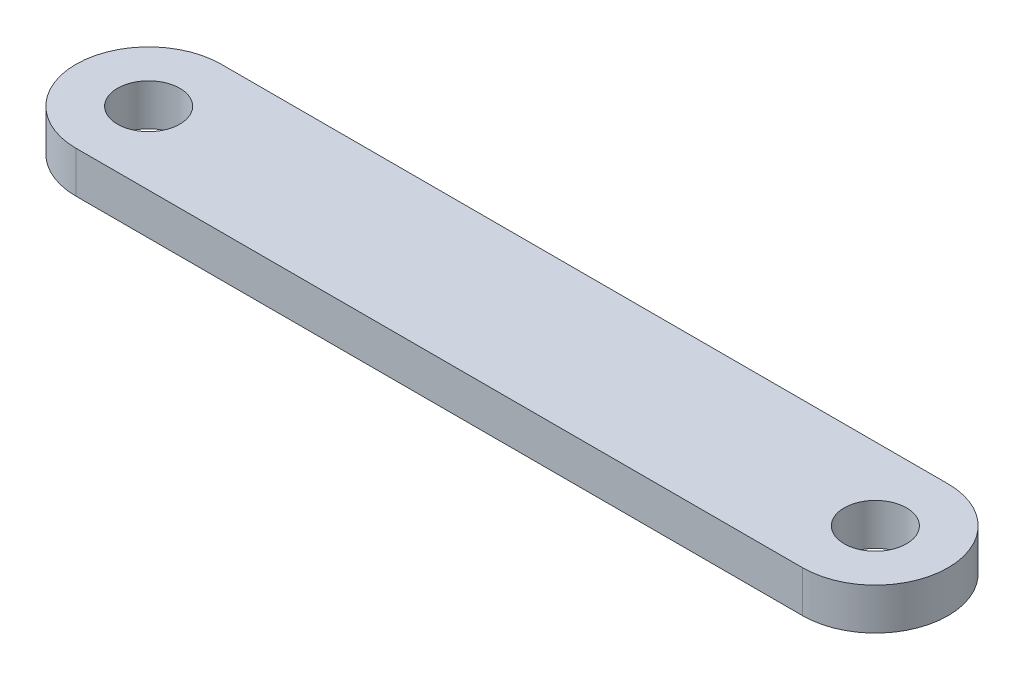
from build123d import *

# Parameters (mm, degrees)
SKETCH1_R           = 1.5
BOSS_EXTRUDE1_DEPTH = 2


with BuildPart() as part:
    # Sketch1 → Boss-Extrude1 (new body)
    with BuildSketch(Plane(origin=(0, 0, 0), x_dir=(1, 0, 0), z_dir=(0, 1, 0))):
        with BuildLine():
            Line((17.495, -3.5), (-17.495, -3.5))
            ThreePointArc((-17.495, -3.5), (-20.995, 0), (-17.495, 3.5))
            Line((-17.495, 3.5), (17.495, 3.5))
            ThreePointArc((17.495, 3.5), (20.995, 0), (17.495, -3.5))
        make_face()
        with Locations(Location((-17.495, 0, 0), (0, 0, 270))):
            Circle(SKETCH1_R, mode=Mode.SUBTRACT)
        with Locations(Location((17.495, 0, 0), (0, 0, 270))):
            Circle(SKETCH1_R, mode=Mode.SUBTRACT)
    extrude(amount=BOSS_EXTRUDE1_DEPTH)


solid = part.part
